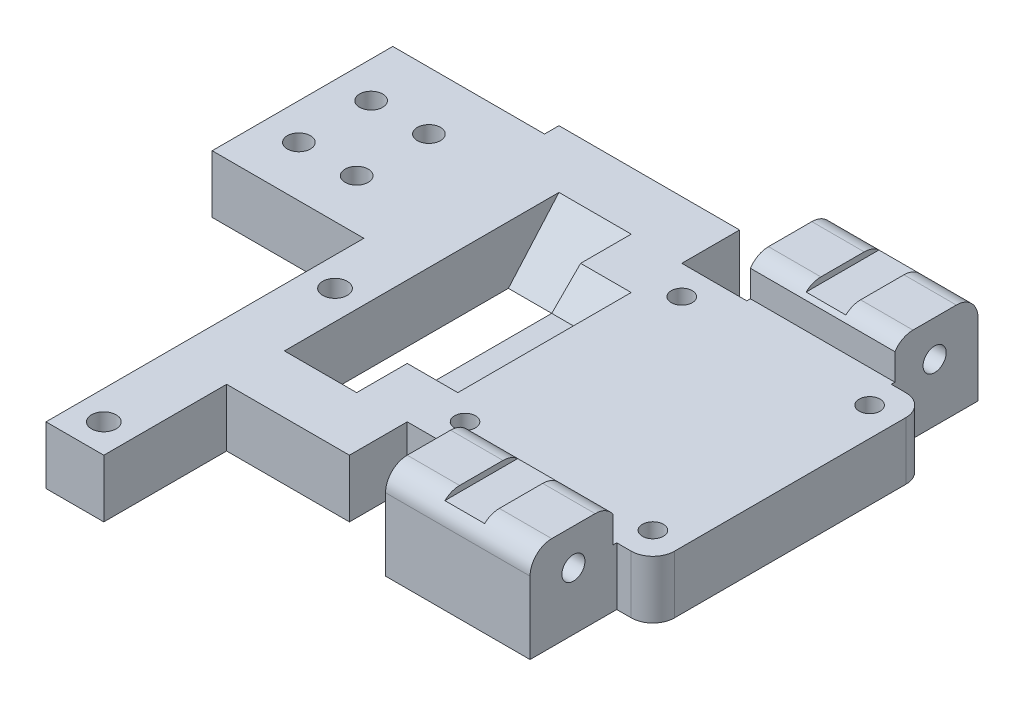
from build123d import *

# Parameters (mm, degrees)
SKETCH1_W            = 300
SKETCH1_H            = 20
BOSS_EXTRUDE1_DEPTH  = 8
SKETCH2_W            = 34
SKETCH2_H            = 8
BOSS_EXTRUDE2_DEPTH  = 9
SKETCH3_W            = 34
SKETCH3_H            = 8
BOSS_EXTRUDE3_DEPTH  = 9
SKETCH4_R            = 1.45
CUT_EXTRUDE1_DEPTH   = 302.504560496
SKETCH5_W            = 25
SKETCH5_H            = 8
BOSS_EXTRUDE4_DEPTH  = 17
SKETCH6_W            = 25
SKETCH6_H            = 8
BOSS_EXTRUDE5_DEPTH  = 17
SKETCH7_W            = 10
SKETCH7_H            = 38
CUT_EXTRUDE2_DEPTH   = 303.37890138
SKETCH8_W            = 7
SKETCH8_H            = 16
CUT_EXTRUDE3_DEPTH   = 4
CUT_EXTRUDE4_DEPTH   = 7
BOSS_EXTRUDE6_DEPTH  = 10
SKETCH12_W           = 8
SKETCH12_H           = 8
BOSS_EXTRUDE7_DEPTH  = 17
SKETCH13_R           = 1.7
CUT_EXTRUDE6_DEPTH   = 305.926220585
SKETCH14_W           = 20
SKETCH14_H           = 13
BOSS_EXTRUDE8_DEPTH  = 12
SKETCH15_R           = 1.6
CUT_EXTRUDE7_DEPTH   = 20
SKETCH16_W           = 20
SKETCH16_H           = 13
BOSS_EXTRUDE9_DEPTH  = 12
SKETCH17_R           = 1.6
CUT_EXTRUDE8_DEPTH   = 20
SKETCH18_W           = 20
SKETCH18_H           = 13
BOSS_EXTRUDE10_DEPTH = 12
CUT_EXTRUDE9_START   = -20
SKETCH19_R           = 1.6
CUT_EXTRUDE9_DEPTH   = 20
SKETCH20_W           = 20
SKETCH20_H           = 13
BOSS_EXTRUDE11_DEPTH = 12
CUT_EXTRUDE10_START  = -20
SKETCH21_R           = 1.6
CUT_EXTRUDE10_DEPTH  = 20
FILLET6_R            = 3
SKETCH28_W           = 198.881436238
SKETCH28_H           = 556.355103816
CUT_EXTRUDE14_DEPTH  = 220
SKETCH29_W           = 21
SKETCH29_H           = 8
BOSS_EXTRUDE12_DEPTH = 15
SKETCH30_W           = 21
SKETCH30_H           = 10
CUT_EXTRUDE15_DEPTH  = 306.0983448
SKETCH31_R           = 1.6
CUT_EXTRUDE16_DEPTH  = 306.0983448
FILLET7_R            = 3
SKETCH32_W           = 5.5
SKETCH32_H           = 70.463459777
CUT_EXTRUDE17_DEPTH  = 0.8
SKETCH33_W           = 20
SKETCH33_H           = 4.963841857
CUT_EXTRUDE18_DEPTH  = 0.5
SKETCH34_W           = 20
SKETCH34_H           = 11.942443484
CUT_EXTRUDE19_DEPTH  = 0.5


with BuildPart() as part:
    # Sketch1 → Boss-Extrude1 (new body)
    with BuildSketch(Plane(origin=(0, 0, 0), x_dir=(1, 0, 0), z_dir=(0, 1, 0))):
        with Locations((150, -10)):
            Rectangle(SKETCH1_W, SKETCH1_H)
    extrude(amount=BOSS_EXTRUDE1_DEPTH)

    # Sketch2 → Boss-Extrude2 (add)
    with BuildSketch(Plane.XY.offset(20)):
        with Locations((17, 4)):
            Rectangle(SKETCH2_W, SKETCH2_H)
        with Locations((283, 4)):
            Rectangle(SKETCH2_W, SKETCH2_H)
    extrude(amount=BOSS_EXTRUDE2_DEPTH)

    # Sketch3 → Boss-Extrude3 (add)
    with BuildSketch(Plane(origin=(0, 0, 0), x_dir=(-1, 0, 0), z_dir=(0, 0, -1))):
        with Locations((-17, 4)):
            Rectangle(SKETCH3_W, SKETCH3_H)
        with Locations((-283, 4)):
            Rectangle(SKETCH3_W, SKETCH3_H)
    extrude(amount=BOSS_EXTRUDE3_DEPTH)

    # Sketch4 → Cut-Extrude1 (cut, through all)
    with BuildSketch(Plane(origin=(0, 8, 0), x_dir=(1, 0, 0), z_dir=(0, 1, 0))):
        with Locations(Location((4, 5, 0), (0, 0, 270))):
            Circle(SKETCH4_R)
        with Locations(Location((30, 5, 0), (0, 0, 270))):
            Circle(SKETCH4_R)
        with Locations(Location((30, -25, 0), (0, 0, 270))):
            Circle(SKETCH4_R)
        with Locations(Location((4, -25, 0), (0, 0, 270))):
            Circle(SKETCH4_R)
        with Locations(Location((296, -25, 0), (0, 0, 270))):
            Circle(SKETCH4_R)
        with Locations(Location((296, 5, 0), (0, 0, 270))):
            Circle(SKETCH4_R)
        with Locations(Location((270, -25, 0), (0, 0, 270))):
            Circle(SKETCH4_R)
        with Locations(Location((270, 5, 0), (0, 0, 270))):
            Circle(SKETCH4_R)
    extrude(amount=-CUT_EXTRUDE1_DEPTH, mode=Mode.SUBTRACT)

    # Sketch5 → Boss-Extrude4 (add)
    with BuildSketch(Plane.XY.offset(20)):
        with Locations((253.5, 4)):
            Rectangle(SKETCH5_W, SKETCH5_H)
    extrude(amount=BOSS_EXTRUDE4_DEPTH)

    # Sketch6 → Boss-Extrude5 (add)
    with BuildSketch(Plane(origin=(0, 0, 0), x_dir=(-1, 0, 0), z_dir=(0, 0, -1))):
        with Locations((-253.5, 4)):
            Rectangle(SKETCH6_W, SKETCH6_H)
    extrude(amount=BOSS_EXTRUDE5_DEPTH)

    # Sketch7 → Cut-Extrude2 (cut, through all)
    with BuildSketch(Plane(origin=(0, 8, 0), x_dir=(1, 0, 0), z_dir=(0, 1, 0))):
        with Locations((254, -10)):
            Rectangle(SKETCH7_W, SKETCH7_H)
    extrude(amount=-CUT_EXTRUDE2_DEPTH, mode=Mode.SUBTRACT)

    # Sketch8 → Cut-Extrude3 (cut)
    with BuildSketch(Plane(origin=(0, 8, 0), x_dir=(1, 0, 0), z_dir=(0, 1, 0))):
        with Locations((262.5, -10)):
            Rectangle(SKETCH8_W, SKETCH8_H)
    extrude(amount=-CUT_EXTRUDE3_DEPTH, mode=Mode.SUBTRACT)

    # Sketch9 → Cut-Extrude4 (cut)
    with BuildSketch(Plane.ZY.offset(-259)):
        Polygon((18, 4), (22, 8), (18, 8), align=None)
        Polygon((2, 4), (-2, 8), (2, 8), align=None)
    extrude(amount=-CUT_EXTRUDE4_DEPTH, mode=Mode.SUBTRACT)

    # Sketch10 → Boss-Extrude6 (add)
    with BuildSketch(Plane.ZY.offset(-259)):
        Polygon((-2, 0), (-9, 8), (-9, 0), align=None)
        Polygon((29, 8), (22, 0), (29, 0), align=None)
    extrude(amount=BOSS_EXTRUDE6_DEPTH)

    # Sketch12 → Boss-Extrude7 (add)
    with BuildSketch(Plane.XY.offset(37)):
        with Locations((245, 4)):
            Rectangle(SKETCH12_W, SKETCH12_H)
    extrude(amount=BOSS_EXTRUDE7_DEPTH)

    # Sketch13 → Cut-Extrude6 (cut, through all)
    with BuildSketch(Plane(origin=(0, 8, 0), x_dir=(1, 0, 0), z_dir=(0, 1, 0))):
        with Locations(Location((245, -50, 0), (0, 0, 270))):
            Circle(SKETCH13_R)
        with Locations(Location((245, -18, 0), (0, 0, 270))):
            Circle(SKETCH13_R)
    extrude(amount=-CUT_EXTRUDE6_DEPTH, mode=Mode.SUBTRACT)

    # Sketch14 → Boss-Extrude8 (add)
    with BuildSketch(Plane.XY.offset(29)):
        with Locations((285, 6.5)):
            Rectangle(SKETCH14_W, SKETCH14_H)
    extrude(amount=BOSS_EXTRUDE8_DEPTH)

    # Sketch15 → Cut-Extrude7 (cut)
    with BuildSketch(Plane(origin=(295, 0, 0), x_dir=(0, 0, -1), z_dir=(1, 0, 0))):
        with Locations((-35, 8)):
            Circle(SKETCH15_R)
    extrude(amount=-CUT_EXTRUDE7_DEPTH, mode=Mode.SUBTRACT)

    # Sketch16 → Boss-Extrude9 (add)
    with BuildSketch(Plane(origin=(0, 0, -9), x_dir=(-1, 0, 0), z_dir=(0, 0, -1))):
        with Locations((-285, 6.5)):
            Rectangle(SKETCH16_W, SKETCH16_H)
    extrude(amount=BOSS_EXTRUDE9_DEPTH)

    # Sketch17 → Cut-Extrude8 (cut)
    with BuildSketch(Plane(origin=(295, 0, 0), x_dir=(0, 0, -1), z_dir=(1, 0, 0))):
        with Locations((15, 8)):
            Circle(SKETCH17_R)
    extrude(amount=-CUT_EXTRUDE8_DEPTH, mode=Mode.SUBTRACT)

    # Sketch18 → Boss-Extrude10 (add)
    with BuildSketch(Plane(origin=(0, 0, -9), x_dir=(-1, 0, 0), z_dir=(0, 0, -1))):
        with Locations((-15, 6.5)):
            Rectangle(SKETCH18_W, SKETCH18_H)
    extrude(amount=BOSS_EXTRUDE10_DEPTH)

    # Sketch19 → Cut-Extrude9 (cut)
    with BuildSketch(Plane.ZY.offset(-5).offset(CUT_EXTRUDE9_START)):
        with Locations(Location((-15, 8, 0), (0, 0, 180))):
            Circle(SKETCH19_R)
    extrude(amount=CUT_EXTRUDE9_DEPTH, mode=Mode.SUBTRACT)

    # Sketch20 → Boss-Extrude11 (add)
    with BuildSketch(Plane.XY.offset(29)):
        with Locations((15, 6.5)):
            Rectangle(SKETCH20_W, SKETCH20_H)
    extrude(amount=BOSS_EXTRUDE11_DEPTH)

    # Sketch21 → Cut-Extrude10 (cut)
    with BuildSketch(Plane.ZY.offset(-5).offset(CUT_EXTRUDE10_START)):
        with Locations(Location((35, 8, 0), (0, 0, 180))):
            Circle(SKETCH21_R)
    extrude(amount=CUT_EXTRUDE10_DEPTH, mode=Mode.SUBTRACT)

    # Fillet6
    fillet6_edges = [part.edges().sort_by_distance(p)[0] for p in [
        (285, 13, 29),
        (285, 13, 41),
        (285, 13, -9),
        (285, 13, -21),
        (15, 13, -9),
        (15, 13, -21),
        (15, 13, 29),
        (15, 13, 41),
    ]]
    fillet(fillet6_edges, radius=FILLET6_R)

    # Sketch28 → Cut-Extrude14 (cut)
    with BuildSketch(Plane.ZY):
        with Locations((-20.495432896, -60.484201615)):
            Rectangle(SKETCH28_W, SKETCH28_H)
    extrude(amount=-CUT_EXTRUDE14_DEPTH, mode=Mode.SUBTRACT)

    # Sketch29 → Boss-Extrude12 (add)
    with BuildSketch(Plane(origin=(0, 0, 0), x_dir=(-1, 0, 0), z_dir=(0, 0, -1))):
        with Locations((-230.5, 4)):
            Rectangle(SKETCH29_W, SKETCH29_H)
    extrude(amount=BOSS_EXTRUDE12_DEPTH)

    # Sketch30 → Cut-Extrude15 (cut, through all)
    with BuildSketch(Plane(origin=(0, 0, 0), x_dir=(-1, 0, 0), z_dir=(0, -1, 0))):
        with Locations((-230.5, -15)):
            Rectangle(SKETCH30_W, SKETCH30_H)
    extrude(amount=-CUT_EXTRUDE15_DEPTH, mode=Mode.SUBTRACT)

    # Sketch31 → Cut-Extrude16 (cut, through all)
    with BuildSketch(Plane(origin=(0, 0, 0), x_dir=(-1, 0, 0), z_dir=(0, -1, 0))):
        with Locations(Location((-225, 7, 0), (0, 0, 90))):
            Circle(SKETCH31_R)
        with Locations(Location((-225, -3, 0), (0, 0, 90))):
            Circle(SKETCH31_R)
        with Locations(Location((-233, 7, 0), (0, 0, 90))):
            Circle(SKETCH31_R)
        with Locations(Location((-233, -3, 0), (0, 0, 90))):
            Circle(SKETCH31_R)
    extrude(amount=-CUT_EXTRUDE16_DEPTH, mode=Mode.SUBTRACT)

    # Fillet7
    fillet7_edges = [part.edges().sort_by_distance(p)[0] for p in [
        (300, 4, 29),
        (300, 4, -9),
    ]]
    fillet(fillet7_edges, radius=FILLET7_R)

    # Sketch32 → Cut-Extrude17 (cut)
    with BuildSketch(Plane(origin=(0, 13, 0), x_dir=(1, 0, 0), z_dir=(0, 1, 0))):
        with Locations((285, -7.2213573)):
            Rectangle(SKETCH32_W, SKETCH32_H)
    extrude(amount=-CUT_EXTRUDE17_DEPTH, mode=Mode.SUBTRACT)

    # Sketch33 → Cut-Extrude18 (cut)
    with BuildSketch(Plane(origin=(0, 0, 29), x_dir=(-1, 0, 0), z_dir=(0, 0, -1))):
        with Locations((-285, 10.481920928)):
            Rectangle(SKETCH33_W, SKETCH33_H)
    extrude(amount=-CUT_EXTRUDE18_DEPTH, mode=Mode.SUBTRACT)

    # Sketch34 → Cut-Extrude19 (cut)
    with BuildSketch(Plane.XY.offset(-9)):
        with Locations((285, 13.971221742)):
            Rectangle(SKETCH34_W, SKETCH34_H)
    extrude(amount=-CUT_EXTRUDE19_DEPTH, mode=Mode.SUBTRACT)


solid = part.part
